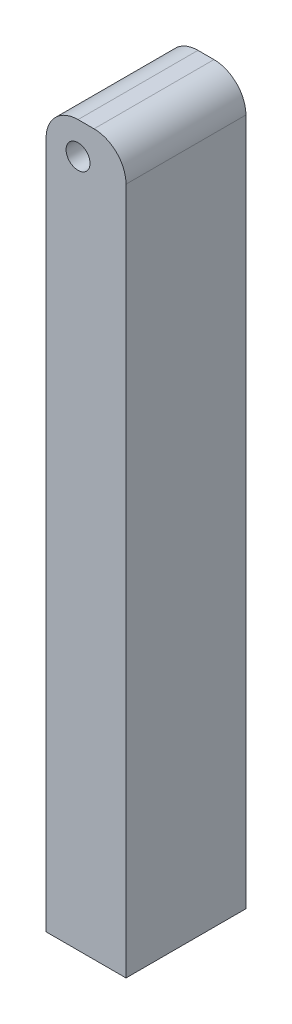
from build123d import *

# Parameters (mm, degrees)
SKETCH_1_R          = 3
EXTRUDE_1_DEPTH     = 15
SKETCH_2_R          = 5
CUT_EXTRUDE_1_DEPTH = 30


with BuildPart() as part:
    # 草图1 → 凸台-拉伸1 (new, symmetric)
    with BuildSketch(Plane.XY):
        with BuildLine():
            Line((8, 0), (12, 0))
            ThreePointArc((12, 0), (17.656854249, -2.343145751), (20, -8))
            Line((20, -8), (20, -180))
            Line((20, -180), (0, -180))
            Line((0, -180), (0, -8))
            ThreePointArc((0, -8), (2.343145751, -2.343145751), (8, 0))
        make_face()
        with Locations((8, -8)):
            Circle(SKETCH_1_R, mode=Mode.SUBTRACT)
    extrude(amount=EXTRUDE_1_DEPTH, both=True)

    # 草图2 → 切除-拉伸1 (cut)
    with BuildSketch(Plane.XZ.offset(180)):
        with Locations(Location((10, 0, 0), (0, 0, 270))):
            Circle(SKETCH_2_R)
    extrude(amount=-CUT_EXTRUDE_1_DEPTH, mode=Mode.SUBTRACT)


solid = part.part
